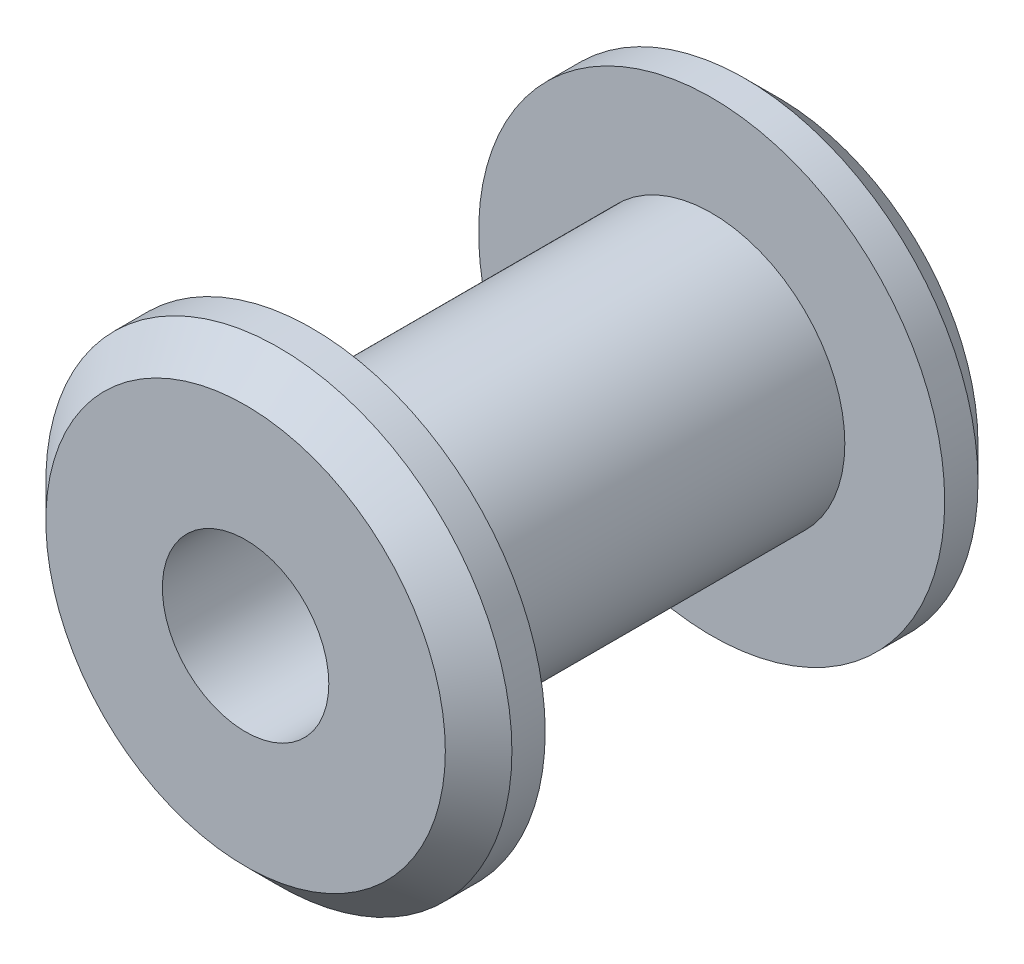
from build123d import *

# Parameters (mm, degrees)
SKETCH1_R               = 4
BOSS_EXTRUDE1_DEPTH     = 6
SKETCH2_R               = 7
BOSS_EXTRUDE2_DEPTH     = 2
LPATTERN1_COUNT         = 2
LPATTERN1_PITCH         = 14
CUT_EXTRUDE1_DEPTH      = 13.727922061
CUT_EXTRUDE1_DEPTH_BACK = 13.727922061
SKETCH3_R               = 2.5
CHAMFER1_SIZE           = 1


with BuildPart() as part:
    # Sketch1 → Boss-Extrude1 (new, symmetric)
    with BuildSketch(Plane.XY):
        Circle(SKETCH1_R)
    extrude(amount=BOSS_EXTRUDE1_DEPTH, both=True)

    # Sketch2 → Boss-Extrude2 (add)
    with BuildSketch(Plane.XY.offset(6)):
        Circle(SKETCH2_R)
    boss_extrude2 = extrude(amount=BOSS_EXTRUDE2_DEPTH)

    # LPattern1: Boss-Extrude2 ×2
    with Locations(*[(0, 0, -i * LPATTERN1_PITCH) for i in range(1, LPATTERN1_COUNT)]):
        add(boss_extrude2)

    # Sketch3 → Cut-Extrude1 (cut, two sides: drawn at the far end of the back side and taken through both)
    with BuildSketch(Plane.XY.offset(-CUT_EXTRUDE1_DEPTH_BACK)):
        Circle(SKETCH3_R)
    extrude(amount=CUT_EXTRUDE1_DEPTH + CUT_EXTRUDE1_DEPTH_BACK, mode=Mode.SUBTRACT)

    # Chamfer1
    chamfer1_edges = [part.edges().sort_by_distance(p)[0] for p in [
        (-7, 0, 8),
        (-7, 0, -8),
    ]]
    chamfer(chamfer1_edges, length=CHAMFER1_SIZE)


solid = part.part
